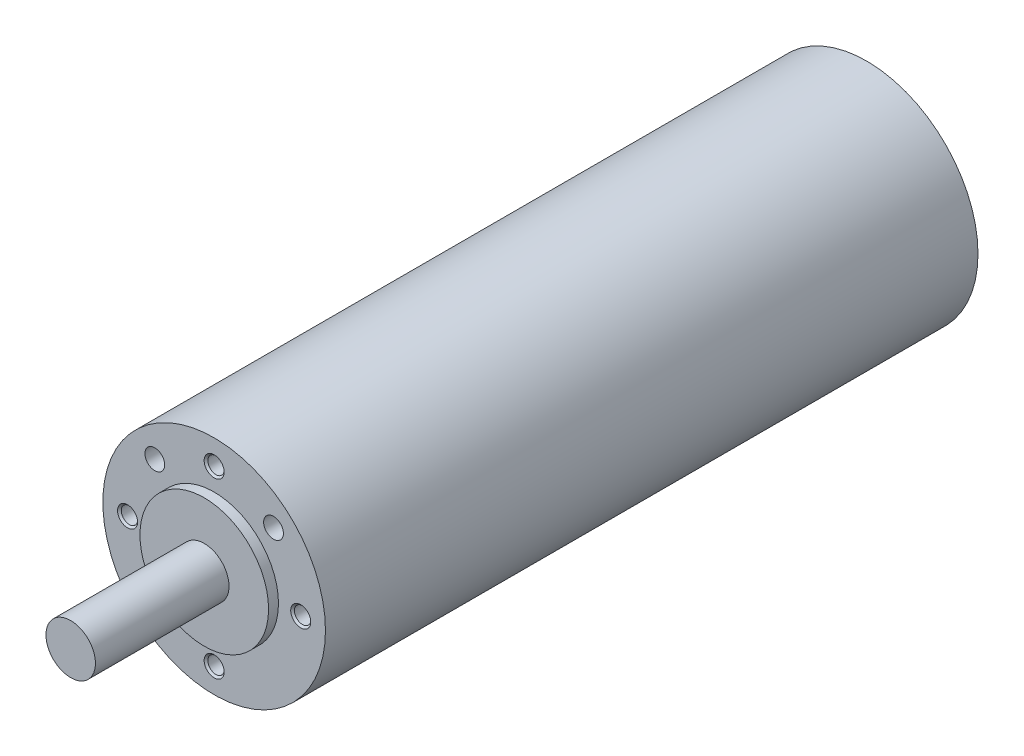
from build123d import *

# Parameters (mm, degrees)
SKETCH1_R                   = 22.5
BOSS_EXTRUDE1_DEPTH         = 131.9
SKETCH2_R                   = 13
BOSS_EXTRUDE2_DEPTH         = 2
SKETCH3_R                   = 5
BOSS_EXTRUDE3_DEPTH         = 27
M4_TAPPED_HOLE1_D           = 3.3
M4_TAPPED_HOLE1_DEPTH       = 9
M4_TAPPED_HOLE1_CSINK_D     = 4.05
M4_TAPPED_HOLE1_CSINK_ANGLE = 90
M4_TAPPED_HOLE1_TIP         = 0.991420021
SKETCH7_R                   = 2
CUT_EXTRUDE1_DEPTH          = 25


with BuildPart() as part:
    # Sketch1 → Boss-Extrude1 (new body)
    with BuildSketch(Plane.XY):
        Circle(SKETCH1_R)
    extrude(amount=-BOSS_EXTRUDE1_DEPTH)

    # Sketch2 → Boss-Extrude2 (add)
    with BuildSketch(Plane.XY):
        Circle(SKETCH2_R)
    extrude(amount=BOSS_EXTRUDE2_DEPTH)

    # Sketch3 → Boss-Extrude3 (add)
    with BuildSketch(Plane.XY.offset(2)):
        Circle(SKETCH3_R)
    extrude(amount=BOSS_EXTRUDE3_DEPTH)

    # M4 Tapped Hole1
    with Locations(Plane.XY):
        with Locations((0, 17.5), (-17.5, 0), (0, -17.5), (17.5, 0)):
            CounterSinkHole(M4_TAPPED_HOLE1_D / 2, M4_TAPPED_HOLE1_CSINK_D / 2, depth=M4_TAPPED_HOLE1_DEPTH, counter_sink_angle=M4_TAPPED_HOLE1_CSINK_ANGLE)
            with Locations((0, 0, -(M4_TAPPED_HOLE1_DEPTH + M4_TAPPED_HOLE1_TIP / 2))):  # 118° drill point
                Cone(0, M4_TAPPED_HOLE1_D / 2, M4_TAPPED_HOLE1_TIP, mode=Mode.SUBTRACT)

    # Sketch7 → Cut-Extrude1 (cut)
    with BuildSketch(Plane.XY):
        with Locations((-12, 12.737739203)):
            Circle(SKETCH7_R)
        with Locations((12, 12.737739203)):
            Circle(SKETCH7_R)
    extrude(amount=-CUT_EXTRUDE1_DEPTH, mode=Mode.SUBTRACT)


solid = part.part
